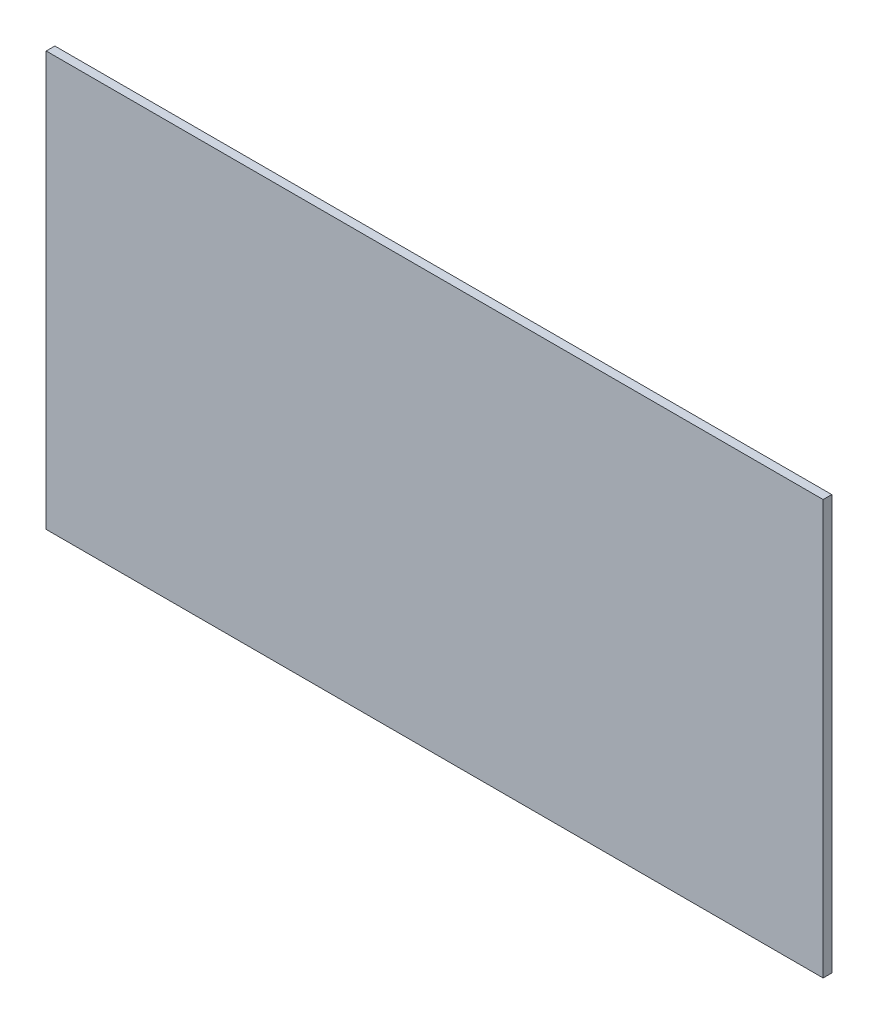
from build123d import *

# Parameters (mm, degrees)
SKETCH1_W           = 1143
SKETCH1_H           = 609.6
BOSS_EXTRUDE1_DEPTH = 12.7


with BuildPart() as part:
    # Sketch1 → Boss-Extrude1 (new body)
    with BuildSketch(Plane.XY):
        with Locations((0, -419.1)):
            Rectangle(SKETCH1_W, SKETCH1_H)
    extrude(amount=BOSS_EXTRUDE1_DEPTH)


solid = part.part
